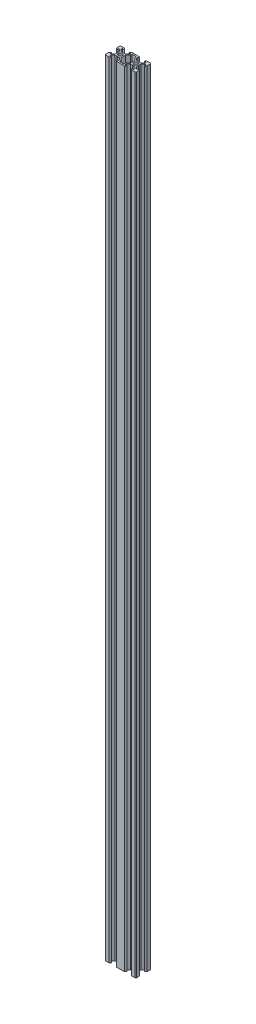
from build123d import *

# Parameters (mm, degrees)
SKETCH13_R                                  = 2.5
RETANGULAR_PF20_12_PERFIL_2040_V_SLOT_DEPTH = 1020


with BuildPart() as part:
    # Sketch13 → Retangular PF20-12 - PERFIL 2040 V-SLOT(1) (new body)
    with BuildSketch(Plane(origin=(0, 0, 0), x_dir=(-1, 0, 0), z_dir=(0, 1, 0))):
        with BuildLine():
            Line((-14.8, 10), (-13, 8.2))
            Line((-13, 8.2), (-15.5, 8.2))
            Line((-15.5, 8.2), (-15.5, 6.560660172))
            Line((-15.5, 6.560660172), (-12.939339828, 4))
            Line((-12.939339828, 4), (-10.3, 4))
            Line((-10.3, 4), (-10, 3.7))
            Line((-10, 3.7), (-9.7, 4))
            Line((-9.7, 4), (-7.060660172, 4))
            Line((-7.060660172, 4), (-4.5, 6.560660172))
            Line((-4.5, 6.560660172), (-4.5, 8.2))
            Line((-4.5, 8.2), (-7, 8.2))
            Line((-7, 8.2), (-5.2, 10))
            Line((-5.2, 10), (5.2, 10))
            Line((5.2, 10), (7, 8.2))
            Line((7, 8.2), (4.5, 8.2))
            Line((4.5, 8.2), (4.5, 6.560660172))
            Line((4.5, 6.560660172), (7.060660172, 4))
            Line((7.060660172, 4), (9.7, 4))
            Line((9.7, 4), (10, 3.7))
            Line((10, 3.7), (10.3, 4))
            Line((10.3, 4), (12.939339828, 4))
            Line((12.939339828, 4), (15.5, 6.560660172))
            Line((15.5, 6.560660172), (15.5, 8.2))
            Line((15.5, 8.2), (13, 8.2))
            Line((13, 8.2), (14.8, 10))
            Line((14.8, 10), (19, 10))
            ThreePointArc((19, 10), (19.707106781, 9.707106781), (20, 9))
            Line((20, 9), (20, 4.8))
            Line((20, 4.8), (18.2, 3))
            Line((18.2, 3), (18.2, 5.5))
            Line((18.2, 5.5), (16.560660172, 5.5))
            Line((16.560660172, 5.5), (14, 2.939339828))
            Line((14, 2.939339828), (14, 0.3))
            Line((14, 0.3), (13.7, 0))
            Line((13.7, 0), (14, -0.3))
            Line((14, -0.3), (14, -2.939339828))
            Line((14, -2.939339828), (16.560660172, -5.5))
            Line((16.560660172, -5.5), (18.2, -5.5))
            Line((18.2, -5.5), (18.2, -3))
            Line((18.2, -3), (20, -4.8))
            Line((20, -4.8), (20, -9))
            ThreePointArc((20, -9), (19.707106781, -9.707106781), (19, -10))
            Line((19, -10), (14.8, -10))
            Line((14.8, -10), (13, -8.2))
            Line((13, -8.2), (15.5, -8.2))
            Line((15.5, -8.2), (15.5, -6.560660172))
            Line((15.5, -6.560660172), (12.939339828, -4))
            Line((12.939339828, -4), (10.3, -4))
            Line((10.3, -4), (10, -3.7))
            Line((10, -3.7), (9.7, -4))
            Line((9.7, -4), (7.060660172, -4))
            Line((7.060660172, -4), (4.5, -6.560660172))
            Line((4.5, -6.560660172), (4.5, -8.2))
            Line((4.5, -8.2), (7, -8.2))
            Line((7, -8.2), (5.2, -10))
            Line((5.2, -10), (-5.2, -10))
            Line((-5.2, -10), (-7, -8.2))
            Line((-7, -8.2), (-4.5, -8.2))
            Line((-4.5, -8.2), (-4.5, -6.560660172))
            Line((-4.5, -6.560660172), (-7.060660172, -4))
            Line((-7.060660172, -4), (-9.7, -4))
            Line((-9.7, -4), (-10, -3.7))
            Line((-10, -3.7), (-10.3, -4))
            Line((-10.3, -4), (-12.939339828, -4))
            Line((-12.939339828, -4), (-15.5, -6.560660172))
            Line((-15.5, -6.560660172), (-15.5, -8.2))
            Line((-15.5, -8.2), (-13, -8.2))
            Line((-13, -8.2), (-14.8, -10))
            Line((-14.8, -10), (-19, -10))
            ThreePointArc((-19, -10), (-19.707106781, -9.707106781), (-20, -9))
            Line((-20, -9), (-20, -4.8))
            Line((-20, -4.8), (-18.2, -3))
            Line((-18.2, -3), (-18.2, -5.5))
            Line((-18.2, -5.5), (-16.560660172, -5.5))
            Line((-16.560660172, -5.5), (-14, -2.939339828))
            Line((-14, -2.939339828), (-14, -0.3))
            Line((-14, -0.3), (-13.7, 0))
            Line((-13.7, 0), (-14, 0.3))
            Line((-14, 0.3), (-14, 2.939339828))
            Line((-14, 2.939339828), (-16.560660172, 5.5))
            Line((-16.560660172, 5.5), (-18.2, 5.5))
            Line((-18.2, 5.5), (-18.2, 3))
            Line((-18.2, 3), (-20, 4.8))
            Line((-20, 4.8), (-20, 9))
            ThreePointArc((-20, 9), (-19.707106781, 9.707106781), (-19, 10))
            Line((-19, 10), (-14.8, 10))
        make_face()
        with Locations((-10, 0)):
            Circle(SKETCH13_R, mode=Mode.SUBTRACT)
        with Locations((10, 0)):
            Circle(SKETCH13_R, mode=Mode.SUBTRACT)
        Polygon((-2.7, 8.2), (-2.7, 6.239339828), (-6, 2.939339828), (-6, -2.939339828), (-2.7, -6.239339828), (-2.7, -8.2), (2.7, -8.2), (2.7, -6.239339828), (6, -2.939339828), (6, 2.939339828), (2.7, 6.239339828), (2.7, 8.2), align=None, mode=Mode.SUBTRACT)
    extrude(amount=RETANGULAR_PF20_12_PERFIL_2040_V_SLOT_DEPTH)


solid = part.part
